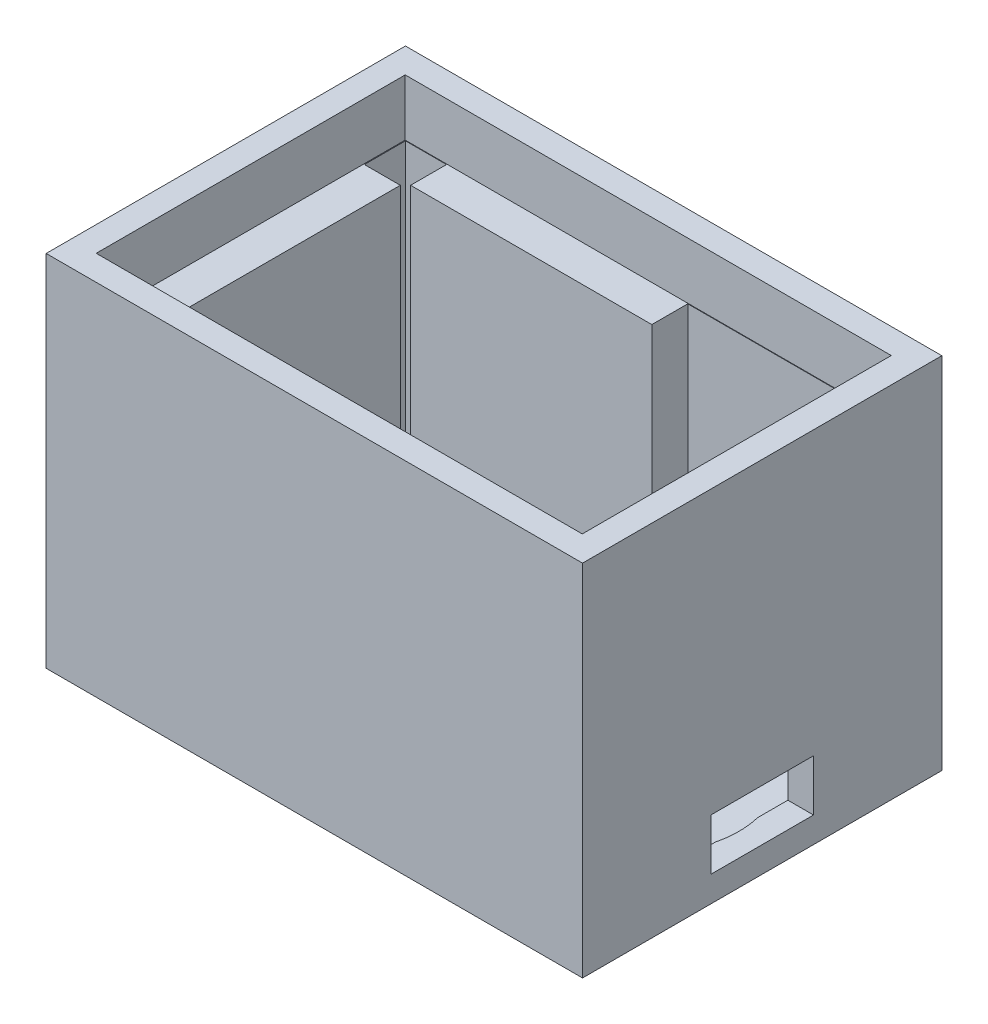
from build123d import *

# Parameters (mm, degrees)
SKETCH1_W           = 104.5
SKETCH1_H           = 70
BOSS_EXTRUDE1_DEPTH = 70
SKETCH2_W           = 94.7
SKETCH2_H           = 60.2
CUT_EXTRUDE1_DEPTH  = 11
CUT_EXTRUDE3_DEPTH  = 55
SKETCH5_W           = 20
SKETCH5_H           = 10
CUT_EXTRUDE4_DEPTH  = 10


with BuildPart() as part:
    # Sketch1 → Boss-Extrude1 (new body)
    with BuildSketch(Plane(origin=(0, 0, 0), x_dir=(1, 0, 0), z_dir=(0, 1, 0))):
        with Locations((52.25, 35)):
            Rectangle(SKETCH1_W, SKETCH1_H)
    extrude(amount=BOSS_EXTRUDE1_DEPTH)

    # Sketch2 → Cut-Extrude1 (cut)
    with BuildSketch(Plane(origin=(0, 70, 0), x_dir=(1, 0, 0), z_dir=(0, 1, 0))):
        with Locations((52.2, 35)):
            Rectangle(SKETCH2_W, SKETCH2_H)
    extrude(amount=-CUT_EXTRUDE1_DEPTH, mode=Mode.SUBTRACT)

    # Sketch3 → Cut-Extrude3 (cut)
    with BuildSketch(Plane(origin=(0, 59, 0), x_dir=(1, 0, 0), z_dir=(0, 1, 0))):
        with BuildLine():
            Line((99.5, 39.153311931), (99.5, 58))
            Line((99.5, 58), (90.5, 58))
            Line((90.5, 58), (90.5, 65))
            Line((90.5, 65), (60, 65))
            Line((60, 65), (60, 58))
            Line((60, 58), (13, 58))
            Line((13, 58), (13, 65))
            Line((13, 65), (5, 65))
            Line((5, 65), (5, 57))
            Line((5, 57), (12, 57))
            Line((12, 57), (12, 12))
            Line((12, 12), (30.952452159, 12))
            ThreePointArc((30.952452159, 12), (33.5, 6.1), (36.047547841, 12))
            Line((36.047547841, 12), (65.092654993, 12))
            ThreePointArc((65.092654993, 12), (68.5, 7.7), (71.907345007, 12))
            Line((71.907345007, 12), (76.805924131, 12))
            ThreePointArc((76.805924131, 12), (82.5, 5.45), (88.194075869, 12))
            Line((88.194075869, 12), (99.5, 12))
            Line((99.5, 12), (99.5, 30.846688069))
            ThreePointArc((99.5, 30.846688069), (100, 35), (99.5, 39.153311931))
        make_face()
    extrude(amount=-CUT_EXTRUDE3_DEPTH, mode=Mode.SUBTRACT)

    # Sketch5 → Cut-Extrude4 (cut)
    with BuildSketch(Plane(origin=(104.5, 0, 0), x_dir=(0, 0, -1), z_dir=(1, 0, 0))):
        with Locations((35, 10)):
            Rectangle(SKETCH5_W, SKETCH5_H)
    extrude(amount=-CUT_EXTRUDE4_DEPTH, mode=Mode.SUBTRACT)


solid = part.part
